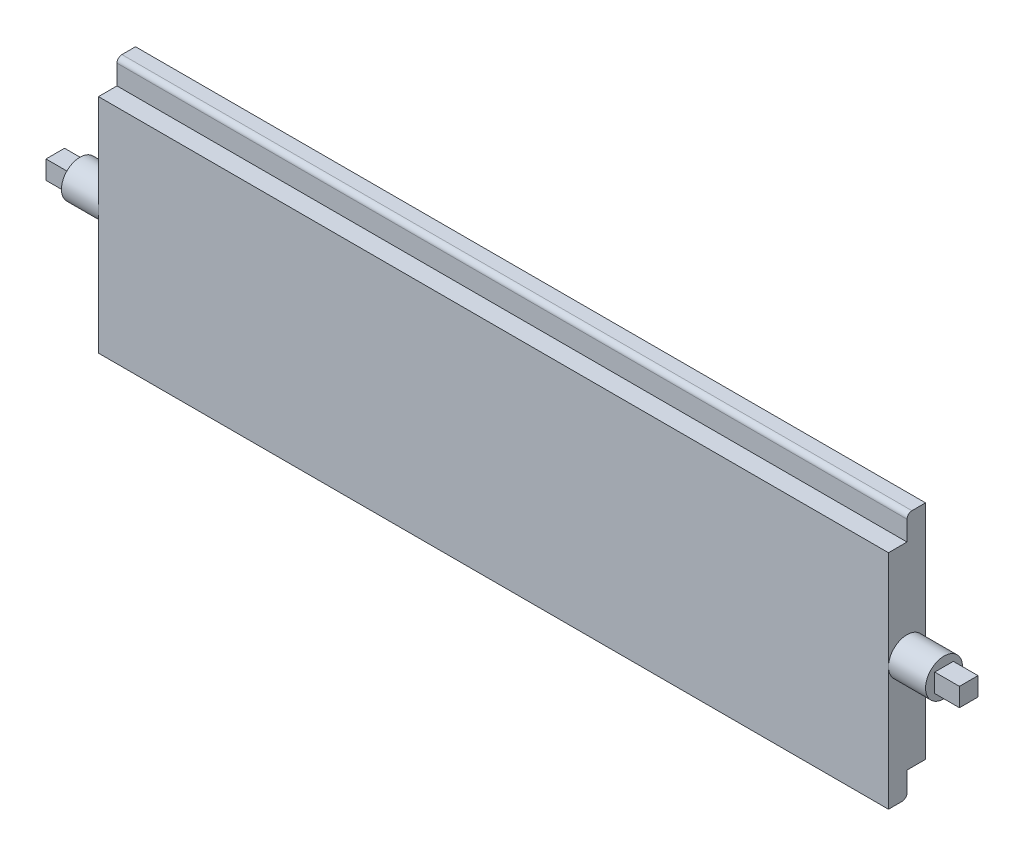
from build123d import *

# Parameters (mm, degrees)
SKETCH1_W           = 203.2
SKETCH1_H           = 63.5
BOSS_EXTRUDE1_DEPTH = 4.7625
SKETCH2_R           = 4.7625
BOSS_EXTRUDE2_DEPTH = 9.525
SKETCH3_W           = 4.7752
SKETCH3_H           = 4.7752
BOSS_EXTRUDE3_DEPTH = 6.35
SKETCH4_W           = 203.2
SKETCH4_H           = 6.35
CUT_EXTRUDE1_DEPTH  = 4.7625
SKETCH5_W           = 203.2
SKETCH5_H           = 6.35
CUT_EXTRUDE2_DEPTH  = 4.7625
FILLET1_R           = 1.27


with BuildPart() as part:
    # Sketch1 → Boss-Extrude1 (new, symmetric)
    with BuildSketch(Plane.XY):
        Rectangle(SKETCH1_W, SKETCH1_H)
    extrude(amount=BOSS_EXTRUDE1_DEPTH, both=True)

    # Sketch2 → Boss-Extrude2 (add)
    with BuildSketch(Plane(origin=(101.6, 0, 0), x_dir=(0, 0, -1), z_dir=(1, 0, 0))):
        Circle(SKETCH2_R)
    boss_extrude2 = extrude(amount=BOSS_EXTRUDE2_DEPTH)

    # Sketch3 → Boss-Extrude3 (add)
    with BuildSketch(Plane(origin=(111.125, 0, 0), x_dir=(0, 0, -1), z_dir=(1, 0, 0))):
        Rectangle(SKETCH3_W, SKETCH3_H)
    boss_extrude3 = extrude(amount=BOSS_EXTRUDE3_DEPTH)

    # Mirror1: Boss-Extrude2, Boss-Extrude3 across plane
    add(boss_extrude2.mirror(Plane(origin=(0, 0, 0), x_dir=(0, 0, 1), z_dir=(1, 0, 0))))
    add(boss_extrude3.mirror(Plane(origin=(0, 0, 0), x_dir=(0, 0, 1), z_dir=(1, 0, 0))))

    # Sketch4 → Cut-Extrude1 (cut)
    with BuildSketch(Plane.XY.offset(4.7625)):
        with Locations((0, 28.575)):
            Rectangle(SKETCH4_W, SKETCH4_H)
    extrude(amount=-CUT_EXTRUDE1_DEPTH, mode=Mode.SUBTRACT)

    # Sketch5 → Cut-Extrude2 (cut)
    with BuildSketch(Plane(origin=(0, 0, -4.7625), x_dir=(-1, 0, 0), z_dir=(0, 0, -1))):
        with Locations((0, -28.575)):
            Rectangle(SKETCH5_W, SKETCH5_H)
    extrude(amount=-CUT_EXTRUDE2_DEPTH, mode=Mode.SUBTRACT)

    # Fillet1
    fillet1_edges = [part.edges().sort_by_distance(p)[0] for p in [
        (0, 31.75, 0),
        (0, -31.75, 0),
    ]]
    fillet(fillet1_edges, radius=FILLET1_R)


solid = part.part
